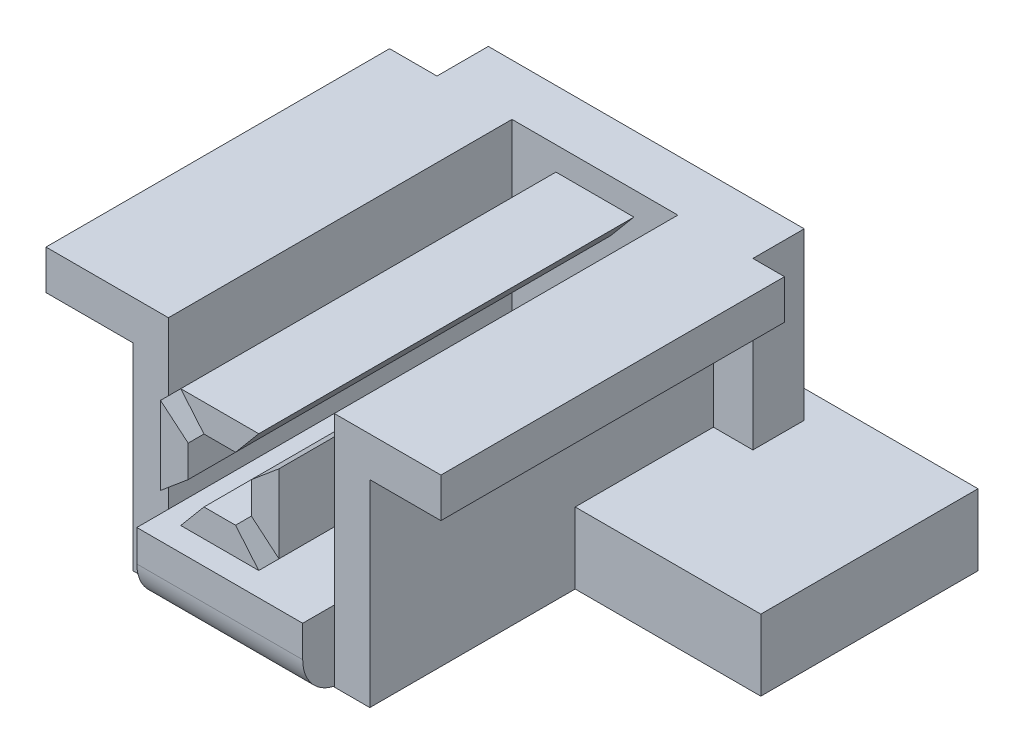
from build123d import *

# Parameters (mm, degrees)
BOSS_EXTRUDE2_DEPTH          = 8
BOSS_EXTRUDE2_DEPTH_BACK     = 1
SKETCH1_R                    = 2.5
CUT_EXTRUDE1_DEPTH           = 79.300702423
CUT_EXTRUDE1_DEPTH_BACK      = 79.300702423
SKETCH2_R                    = 2.5
SKETCH3_R                    = 3.25
CUT_EXTRUDE5_DEPTH           = 15
CUT_EXTRUDE5_DRAFT           = -0.0573
CUT_EXTRUDE5_PROFILE_2_DEPTH = 15
CUT_EXTRUDE5_PROFILE_2_DRAFT = -0.0573
SKETCH5_W                    = 9
SKETCH5_H                    = 6.5
BOSS_EXTRUDE3_DEPTH          = 14.5
CUT_EXTRUDE4_DEPTH           = 1.5
SKETCH12_W                   = 21
SKETCH12_H                   = 30
BOSS_EXTRUDE7_DEPTH          = 9
SKETCH15_W                   = 9
SKETCH15_H                   = 6.5
BOSS_EXTRUDE8_DEPTH          = 3.5
BOSS_EXTRUDE9_DEPTH          = 54
FILLET4_R                    = 5
SKETCH18_W                   = 9.873697418
SKETCH18_H                   = 6.5
BOSS_EXTRUDE11_DEPTH         = 0.5
SKETCH20_W                   = 4
SKETCH20_H                   = 17.5
BOSS_EXTRUDE12_DEPTH         = 18
BOSS_EXTRUDE13_DEPTH         = 11
BOSS_EXTRUDE13_DEPTH_BACK    = 4
SKETCH22_W                   = 17.5
SKETCH22_H                   = 4
SKETCH25_W                   = 2
SKETCH25_H                   = 17.5
BOSS_EXTRUDE14_DEPTH         = 41
SKETCH28_W                   = 41
SKETCH28_H                   = 45
BOSS_EXTRUDE15_DEPTH         = 2
SKETCH29_R                   = 1.75
CUT_EXTRUDE8_DEPTH           = 9
BOSS_EXTRUDE16_DEPTH         = 9
BOSS_EXTRUDE16_DEPTH_BACK    = 4
SKETCH30_W                   = 17.5
SKETCH30_H                   = 4
SKETCH31_R                   = 10
CUT_EXTRUDE9_DEPTH           = 9
SKETCH32_W                   = 13
SKETCH32_H                   = 4
BOSS_EXTRUDE17_DEPTH         = 23.5
SKETCH33_W                   = 0.5
SKETCH33_H                   = 17.5
BOSS_EXTRUDE18_DEPTH         = 20
BOSS_EXTRUDE19_DEPTH         = 26
SKETCH35_W                   = 9.873697418
SKETCH35_H                   = 0.5
BOSS_EXTRUDE20_DEPTH         = 47.5
BOSS_EXTRUDE21_DEPTH         = 47.5
SKETCH38_W                   = 0.419549816
SKETCH38_H                   = 18.5
CUT_EXTRUDE10_DEPTH          = 90.5
SKETCH46_W                   = 27.5
SKETCH46_H                   = 9
BOSS_EXTRUDE26_DEPTH         = 11.5
SKETCH47_W                   = 27.5
SKETCH47_H                   = 9
BOSS_EXTRUDE27_DEPTH         = 11
SKETCH48_W                   = 15.5
SKETCH48_H                   = 6.5
BOSS_EXTRUDE31_DEPTH         = 18.5
SKETCH50_R                   = 4
CUT_EXTRUDE11_DEPTH          = 1.5
SKETCH51_W                   = 9.626242636
SKETCH51_H                   = 9.125298808
BOSS_EXTRUDE32_DEPTH         = 1.5
SKETCH54_W                   = 8
SKETCH54_H                   = 8
BOSS_EXTRUDE35_DEPTH         = 47.5
SKETCH55_W                   = 9.873697418
SKETCH55_H                   = 0.5
CUT_EXTRUDE12_DEPTH          = 47.5
BOSS_EXTRUDE37_DEPTH         = 47.5
CUT_EXTRUDE17_DEPTH          = 47.5
SKETCH62_W                   = 8
SKETCH62_H                   = 8
CUT_EXTRUDE18_DEPTH          = 47.5
SKETCH63_W                   = 13
SKETCH63_H                   = 4
CUT_EXTRUDE20_DEPTH          = 17
SKETCH64_W                   = 0.5
SKETCH64_H                   = 1.5
BOSS_EXTRUDE38_DEPTH         = 6.5
SKETCH65_W                   = 11
SKETCH65_H                   = 27.5
SKETCH65_R                   = 2.5
CUT_EXTRUDE22_DEPTH          = 9
FILLET6_R                    = 5
BOSS_EXTRUDE39_DEPTH         = 11
BOSS_EXTRUDE39_DEPTH_BACK    = 10
SKETCH67_W                   = 27.5
SKETCH67_H                   = 9
SKETCH68_W                   = 2
SKETCH68_H                   = 45
CUT_EXTRUDE23_DEPTH          = 17
SKETCH69_W                   = 2
SKETCH69_H                   = 41
CUT_EXTRUDE24_DEPTH          = 37
CUT_EXTRUDE25_DEPTH          = 6.5
SKETCH71_W                   = 40
SKETCH71_H                   = 6.5
BOSS_EXTRUDE40_DEPTH         = 1.5
BOSS_EXTRUDE41_DEPTH         = 1


with BuildPart() as part:
    # Sketch1 → Boss-Extrude2 (new, two sides: drawn at the far end of the back side and taken through both)
    with BuildSketch(Plane(origin=(0, 0, 0), x_dir=(1, 0, 0), z_dir=(0, 1, 0)).offset(-BOSS_EXTRUDE2_DEPTH_BACK)):
        with BuildLine():
            Line((5, 0), (50, 0))
            ThreePointArc((50, 0), (53.535533906, 1.464466094), (55, 5))
            Line((55, 5), (55, 50))
            ThreePointArc((55, 50), (53.535533906, 53.535533906), (50, 55))
            Line((50, 55), (5, 55))
            ThreePointArc((5, 55), (1.464466094, 53.535533906), (0, 50))
            Line((0, 50), (0, 5))
            ThreePointArc((0, 5), (1.464466094, 1.464466094), (5, 0))
        make_face()
        with Locations((7.5, 47.5)):
            Circle(SKETCH1_R, mode=Mode.SUBTRACT)
        with Locations((47.5, 47.5)):
            Circle(SKETCH1_R, mode=Mode.SUBTRACT)
        with Locations((47.5, 7.5)):
            Circle(SKETCH1_R, mode=Mode.SUBTRACT)
        with Locations((7.5, 7.5)):
            Circle(SKETCH1_R, mode=Mode.SUBTRACT)
    extrude(amount=BOSS_EXTRUDE2_DEPTH + BOSS_EXTRUDE2_DEPTH_BACK)

    # Sketch2 → Cut-Extrude1 (cut, two sides: drawn at the far end of the back side and taken through both)
    with BuildSketch(Plane(origin=(0, 8, 0), x_dir=(1, 0, 0), z_dir=(0, 1, 0)).offset(-CUT_EXTRUDE1_DEPTH_BACK)):
        with BuildLine():
            Line((0, 50), (0, 27.5))
            Line((0, 27.5), (55, 27.5))
            Line((55, 27.5), (55, 50))
            ThreePointArc((55, 50), (53.535533906, 53.535533906), (50, 55))
            Line((50, 55), (5, 55))
            ThreePointArc((5, 55), (1.464466094, 53.535533906), (0, 50))
        make_face()
        with Locations((7.5, 47.5)):
            Circle(SKETCH2_R, mode=Mode.SUBTRACT)
        with Locations((47.5, 47.5)):
            Circle(SKETCH2_R, mode=Mode.SUBTRACT)
    extrude(amount=CUT_EXTRUDE1_DEPTH + CUT_EXTRUDE1_DEPTH_BACK, mode=Mode.SUBTRACT)


with BuildPart() as cut_extrude5_tool:
    # Sketch3 → Cut-Extrude5 (with draft: the straight prism first)
    with BuildSketch(Plane(origin=(0, 0, -27.5), x_dir=(-1, 0, 0), z_dir=(0, 0, -1))):
        with Locations((-37.5, 3.5)):
            Circle(SKETCH3_R)
    extrude(amount=-CUT_EXTRUDE5_DEPTH)
    # Cut-Extrude5: the draft: its side faces are tilted about the plane it starts from
    cut_extrude5_sides = [cut_extrude5_tool.faces().sort_by_distance(p)[0] for p in [
        (40.75, 3.5, -20),
    ]]
    draft(cut_extrude5_sides, Plane(origin=(0, 0, -27.5), x_dir=(-1, 0, 0), z_dir=(0, 0, -1)), CUT_EXTRUDE5_DRAFT)


with BuildPart() as part_1:
    add(part.part)

    # Cut-Extrude5: cut by cut_extrude5_tool
    add(cut_extrude5_tool.part, mode=Mode.SUBTRACT)


with BuildPart() as cut_extrude5_profile_2_tool:
    # Sketch3 → Cut-Extrude5 profile 2 (with draft: the straight prism first)
    with BuildSketch(Plane(origin=(0, 0, -27.5), x_dir=(-1, 0, 0), z_dir=(0, 0, -1))):
        with Locations((-17.5, 3.5)):
            Circle(SKETCH3_R)
    extrude(amount=-CUT_EXTRUDE5_PROFILE_2_DEPTH)
    # Cut-Extrude5 profile 2: the draft: its side faces are tilted about the plane it starts from
    cut_extrude5_profile_2_sides = [cut_extrude5_profile_2_tool.faces().sort_by_distance(p)[0] for p in [
        (20.75, 3.5, -20),
    ]]
    draft(cut_extrude5_profile_2_sides, Plane(origin=(0, 0, -27.5), x_dir=(-1, 0, 0), z_dir=(0, 0, -1)), CUT_EXTRUDE5_PROFILE_2_DRAFT)


with BuildPart() as part_2:
    add(part_1.part)

    # Cut-Extrude5 profile 2: cut by cut_extrude5_profile_2_tool
    add(cut_extrude5_profile_2_tool.part, mode=Mode.SUBTRACT)

    # Sketch5 → Boss-Extrude3 (add)
    with BuildSketch(Plane(origin=(0, 8, 0), x_dir=(1, 0, 0), z_dir=(0, 1, 0))):
        with Locations((27.5, 20.75)):
            Rectangle(SKETCH5_W, SKETCH5_H)
    extrude(amount=BOSS_EXTRUDE3_DEPTH)

    # Sketch6 → Cut-Extrude4 (cut)
    with BuildSketch(Plane(origin=(0, 0, -24), x_dir=(-1, 0, 0), z_dir=(0, 0, -1))):
        with BuildLine():
            ThreePointArc((-27.5, 13), (-24.671572875, 14.171572875), (-23.5, 17))
            ThreePointArc((-23.5, 17), (-30.328427125, 19.828427125), (-27.5, 13))
        make_face()
    extrude(amount=-CUT_EXTRUDE4_DEPTH, mode=Mode.SUBTRACT)

    # Sketch12 → Boss-Extrude7 (add)
    with BuildSketch(Plane(origin=(0, 8, 0), x_dir=(1, 0, 0), z_dir=(0, 1, 0))):
        with Locations((27.5, -15)):
            Rectangle(SKETCH12_W, SKETCH12_H)
    extrude(amount=-BOSS_EXTRUDE7_DEPTH)

    # Sketch15 → Boss-Extrude8 (add)
    with BuildSketch(Plane(origin=(0, 22.5, 0), x_dir=(1, 0, 0), z_dir=(0, 1, 0))):
        with Locations((27.5, 20.75)):
            Rectangle(SKETCH15_W, SKETCH15_H)
    extrude(amount=BOSS_EXTRUDE8_DEPTH)

    # Sketch11 → Boss-Extrude9 (add)
    with BuildSketch(Plane(origin=(0, 0, -24), x_dir=(-1, 0, 0), z_dir=(0, 0, -1))):
        Polygon((-29.5, 22.5), (-25.5, 22.5), (-22.563151291, 26), (-32.436848709, 26), align=None)
    extrude(amount=-BOSS_EXTRUDE9_DEPTH)

    # Fillet4
    fillet4_edges = [part_2.edges().sort_by_distance(p)[0] for p in [
        (27.5, -1, 30),
    ]]
    fillet(fillet4_edges, radius=FILLET4_R)

    # Sketch18 → Boss-Extrude11 (add)
    with BuildSketch(Plane(origin=(0, 26, 0), x_dir=(1, 0, 0), z_dir=(0, 1, 0))):
        with Locations((27.5, 20.75)):
            Rectangle(SKETCH18_W, SKETCH18_H)
    extrude(amount=BOSS_EXTRUDE11_DEPTH)

    # Sketch20 → Boss-Extrude12 (add)
    with BuildSketch(Plane(origin=(0, 8, 0), x_dir=(1, 0, 0), z_dir=(0, 1, 0))):
        with Locations((14.5, 8.75)):
            Rectangle(SKETCH20_W, SKETCH20_H)
        with Locations((40.5, 8.75)):
            Rectangle(SKETCH20_W, SKETCH20_H)
    extrude(amount=BOSS_EXTRUDE12_DEPTH)

    # Sketch22 → Boss-Extrude13 (add, two sides: drawn at the far end of the back side and taken through both)
    with BuildSketch(Plane.ZY.offset(-12.5).offset(-BOSS_EXTRUDE13_DEPTH_BACK)):
        with Locations((-8.75, 26)):
            Rectangle(SKETCH22_W, SKETCH22_H)
    extrude(amount=BOSS_EXTRUDE13_DEPTH + BOSS_EXTRUDE13_DEPTH_BACK)

    # Sketch25 → Boss-Extrude14 (add)
    with BuildSketch(Plane(origin=(0, 28, 0), x_dir=(1, 0, 0), z_dir=(0, 1, 0))):
        with Locations((2.5, 8.75)):
            Rectangle(SKETCH25_W, SKETCH25_H)
    extrude(amount=BOSS_EXTRUDE14_DEPTH)

    # Sketch28 → Boss-Extrude15 (add)
    with BuildSketch(Plane.ZY.offset(-1.5)):
        with Locations((-20.5, 46.5)):
            Rectangle(SKETCH28_W, SKETCH28_H)
    extrude(amount=-BOSS_EXTRUDE15_DEPTH)

    # Sketch29 → Cut-Extrude8 (cut)
    with BuildSketch(Plane.ZY.offset(-1.5)):
        with Locations((-5, 33)):
            Circle(SKETCH29_R)
        with Locations((-36, 33)):
            Circle(SKETCH29_R)
        with Locations((-36, 64)):
            Circle(SKETCH29_R)
        with Locations((-5, 64)):
            Circle(SKETCH29_R)
    extrude(amount=-CUT_EXTRUDE8_DEPTH, mode=Mode.SUBTRACT)

    # Sketch30 → Boss-Extrude16 (add, two sides: drawn at the far end of the back side and taken through both)
    with BuildSketch(Plane(origin=(42.5, 0, 0), x_dir=(0, 0, -1), z_dir=(1, 0, 0)).offset(-BOSS_EXTRUDE16_DEPTH_BACK)):
        with Locations((8.75, 26)):
            Rectangle(SKETCH30_W, SKETCH30_H)
    extrude(amount=BOSS_EXTRUDE16_DEPTH + BOSS_EXTRUDE16_DEPTH_BACK)

    # Sketch31 → Cut-Extrude9 (cut)
    with BuildSketch(Plane(origin=(3.5, 0, 0), x_dir=(0, 0, -1), z_dir=(1, 0, 0))):
        with Locations((20.5, 47)):
            Circle(SKETCH31_R)
    extrude(amount=-CUT_EXTRUDE9_DEPTH, mode=Mode.SUBTRACT)

    # Sketch32 → Boss-Extrude17 (add)
    with BuildSketch(Plane(origin=(0, 0, -17.5), x_dir=(-1, 0, 0), z_dir=(0, 0, -1))):
        with Locations((-10, 26)):
            Rectangle(SKETCH32_W, SKETCH32_H)
    extrude(amount=BOSS_EXTRUDE17_DEPTH)

    # Sketch33 → Boss-Extrude18 (add)
    with BuildSketch(Plane(origin=(0, 8, 0), x_dir=(1, 0, 0), z_dir=(0, 1, 0))):
        with Locations((38.25, 8.75)):
            Rectangle(SKETCH33_W, SKETCH33_H)
        with Locations((16.75, 8.75)):
            Rectangle(SKETCH33_W, SKETCH33_H)
    extrude(amount=BOSS_EXTRUDE18_DEPTH)

    # Sketch34 → Boss-Extrude19 (add)
    with BuildSketch(Plane.XY):
        Polygon((51.5, 24), (51.5, 28), (38, 28), (38, -1), (42.5, -1), (42.5, 24), align=None)
        Polygon((17, 28), (1.5, 28), (1.5, 24), (12.5, 24), (12.5, -1), (17, -1), align=None)
    extrude(amount=BOSS_EXTRUDE19_DEPTH)

    # Sketch35 → Boss-Extrude20 (add)
    with BuildSketch(Plane.XY.offset(-17.5)):
        with Locations((27.5, 26.25)):
            Rectangle(SKETCH35_W, SKETCH35_H)
    extrude(amount=BOSS_EXTRUDE20_DEPTH)

    # Sketch37 → Boss-Extrude21 (add)
    with BuildSketch(Plane.XY.offset(-17.5)):
        Polygon((29.5, 12), (25.5, 12), (21.863844179, 7.666598237), (33.136155821, 7.666598237), align=None)
    extrude(amount=BOSS_EXTRUDE21_DEPTH)

    # Sketch38 → Cut-Extrude10 (cut)
    with BuildSketch(Plane.XY.offset(30)):
        with Locations((22.353376383, 17.25)):
            Rectangle(SKETCH38_W, SKETCH38_H)
        with Locations((32.646623617, 17.25)):
            Rectangle(SKETCH38_W, SKETCH38_H)
    extrude(amount=-CUT_EXTRUDE10_DEPTH, mode=Mode.SUBTRACT)

    # Sketch46 → Boss-Extrude26 (add)
    with BuildSketch(Plane.ZY):
        with Locations((-13.75, 3.5)):
            Rectangle(SKETCH46_W, SKETCH46_H)
    extrude(amount=-BOSS_EXTRUDE26_DEPTH)

    # Sketch47 → Boss-Extrude27 (add)
    with BuildSketch(Plane.ZY):
        with Locations((-13.75, 3.5)):
            Rectangle(SKETCH47_W, SKETCH47_H)
    extrude(amount=BOSS_EXTRUDE27_DEPTH)

    # Sketch48 → Boss-Extrude31 (add)
    with BuildSketch(Plane(origin=(0, 8, 0), x_dir=(1, 0, 0), z_dir=(0, 1, 0))):
        with Locations((15.25, 20.75)):
            Rectangle(SKETCH48_W, SKETCH48_H)
        with Locations((39.75, 20.75)):
            Rectangle(SKETCH48_W, SKETCH48_H)
    extrude(amount=BOSS_EXTRUDE31_DEPTH)

    # Sketch50 → Cut-Extrude11 (cut)
    with BuildSketch(Plane(origin=(0, 0, -24), x_dir=(-1, 0, 0), z_dir=(0, 0, -1))):
        with Locations((-17.5, 17)):
            Circle(SKETCH50_R)
        with Locations((-37.5, 17)):
            Circle(SKETCH50_R)
    extrude(amount=-CUT_EXTRUDE11_DEPTH, mode=Mode.SUBTRACT)

    # Sketch51 → Boss-Extrude32 (add)
    with BuildSketch(Plane(origin=(0, 0, -24), x_dir=(-1, 0, 0), z_dir=(0, 0, -1))):
        with Locations((-27.646184708, 17.114099589)):
            Rectangle(SKETCH51_W, SKETCH51_H)
    extrude(amount=-BOSS_EXTRUDE32_DEPTH)

    # Sketch54 → Boss-Extrude35 (add)
    with BuildSketch(Plane.XY.offset(-17.5)):
        with Locations((27.5, 18.5)):
            Rectangle(SKETCH54_W, SKETCH54_H)
    extrude(amount=BOSS_EXTRUDE35_DEPTH)

    # Sketch55 → Cut-Extrude12 (cut)
    with BuildSketch(Plane.XY.offset(30)):
        with Locations((27.5, 26.25)):
            Rectangle(SKETCH55_W, SKETCH55_H)
    extrude(amount=-CUT_EXTRUDE12_DEPTH, mode=Mode.SUBTRACT)

    # Sketch57 → Boss-Extrude37 (add)
    with BuildSketch(Plane.XY.offset(30)):
        Polygon((35, 23.436848709), (31.5, 20.5), (31.5, 16.5), (35, 13.563151291), align=None)
        Polygon((20, 13.563151291), (23.5, 16.5), (23.5, 20.5), (20, 23.436848709), align=None)
        Polygon((32.436848709, 11), (29.5, 14.5), (25.5, 14.5), (22.563151291, 11), align=None)
    extrude(amount=-BOSS_EXTRUDE37_DEPTH)

    # Sketch61 → Cut-Extrude17 (cut)
    with BuildSketch(Plane.XY.offset(30)):
        Polygon((32.436848709, 8), (22.563151291, 8), (22.563151291, 8.5), (24.660900369, 11), (30.339099631, 11), (32.436848709, 8.5), align=None)
    extrude(amount=-CUT_EXTRUDE17_DEPTH, mode=Mode.SUBTRACT)

    # Sketch62 → Cut-Extrude18 (cut)
    with BuildSketch(Plane.XY.offset(30)):
        with Locations((27.5, 18.5)):
            Rectangle(SKETCH62_W, SKETCH62_H)
    extrude(amount=-CUT_EXTRUDE18_DEPTH, mode=Mode.SUBTRACT)

    # Sketch63 → Cut-Extrude20 (cut)
    with BuildSketch(Plane(origin=(0, 0, -41), x_dir=(-1, 0, 0), z_dir=(0, 0, -1))):
        with Locations((-10, 26)):
            Rectangle(SKETCH63_W, SKETCH63_H)
    extrude(amount=-CUT_EXTRUDE20_DEPTH, mode=Mode.SUBTRACT)

    # Sketch64 → Boss-Extrude38 (add)
    with BuildSketch(Plane(origin=(0, 0, -17.5), x_dir=(-1, 0, 0), z_dir=(0, 0, -1))):
        with Locations((-16.75, 27.25)):
            Rectangle(SKETCH64_W, SKETCH64_H)
    extrude(amount=BOSS_EXTRUDE38_DEPTH)

    # Sketch65 → Cut-Extrude22 (cut)
    with BuildSketch(Plane(origin=(0, 8, 0), x_dir=(1, 0, 0), z_dir=(0, 1, 0))):
        with Locations((-5.5, 13.75)):
            Rectangle(SKETCH65_W, SKETCH65_H)
        with Locations((7.5, 7.5)):
            Circle(SKETCH65_R)
    extrude(amount=-CUT_EXTRUDE22_DEPTH, mode=Mode.SUBTRACT)

    # Fillet6
    fillet6_edges = [part_2.edges().sort_by_distance(p)[0] for p in [
        (0, 3.5, 0),
    ]]
    fillet(fillet6_edges, radius=FILLET6_R)

    # Sketch67 → Boss-Extrude39 (add, two sides: drawn at the far end of the back side and taken through both)
    with BuildSketch(Plane(origin=(55, 0, 0), x_dir=(0, 0, -1), z_dir=(1, 0, 0)).offset(-BOSS_EXTRUDE39_DEPTH_BACK)):
        with Locations((13.75, 3.5)):
            Rectangle(SKETCH67_W, SKETCH67_H)
    extrude(amount=BOSS_EXTRUDE39_DEPTH + BOSS_EXTRUDE39_DEPTH_BACK)

    # Sketch68 → Cut-Extrude23 (cut)
    with BuildSketch(Plane(origin=(0, 0, -41), x_dir=(-1, 0, 0), z_dir=(0, 0, -1))):
        with Locations((-2.5, 46.5)):
            Rectangle(SKETCH68_W, SKETCH68_H)
    extrude(amount=-CUT_EXTRUDE23_DEPTH, mode=Mode.SUBTRACT)

    # Sketch69 → Cut-Extrude24 (cut)
    with BuildSketch(Plane(origin=(0, 0, -24), x_dir=(-1, 0, 0), z_dir=(0, 0, -1))):
        with Locations((-2.5, 48.5)):
            Rectangle(SKETCH69_W, SKETCH69_H)
    extrude(amount=-CUT_EXTRUDE24_DEPTH, mode=Mode.SUBTRACT)

    # Sketch70 → Cut-Extrude25 (cut)
    with BuildSketch(Plane(origin=(0, 0, -24), x_dir=(-1, 0, 0), z_dir=(0, 0, -1))):
        Polygon((-17.5, 28), (-17.5, 26.5), (-7.5, 26.5), (-7.5, 24), (-1.5, 24), (-1.5, 28), align=None)
    extrude(amount=-CUT_EXTRUDE25_DEPTH, mode=Mode.SUBTRACT)

    # Sketch71 → Boss-Extrude40 (add)
    with BuildSketch(Plane(origin=(0, 26.5, 0), x_dir=(1, 0, 0), z_dir=(0, 1, 0))):
        with Locations((27.5, 20.75)):
            Rectangle(SKETCH71_W, SKETCH71_H)
    extrude(amount=BOSS_EXTRUDE40_DEPTH)

    # Sketch72 → Boss-Extrude41 (add)
    with BuildSketch(Plane(origin=(0, 28, 0), x_dir=(1, 0, 0), z_dir=(0, 1, 0))):
        Polygon((1.5, 17.5), (7.5, 17.5), (7.5, 24), (47.5, 24), (47.5, 17.5), (51.5, 17.5), (51.5, -26), (38, -26), (38, 17.5), (17, 17.5), (17, -26), (1.5, -26), align=None)
    extrude(amount=BOSS_EXTRUDE41_DEPTH)


solid = part_2.part
